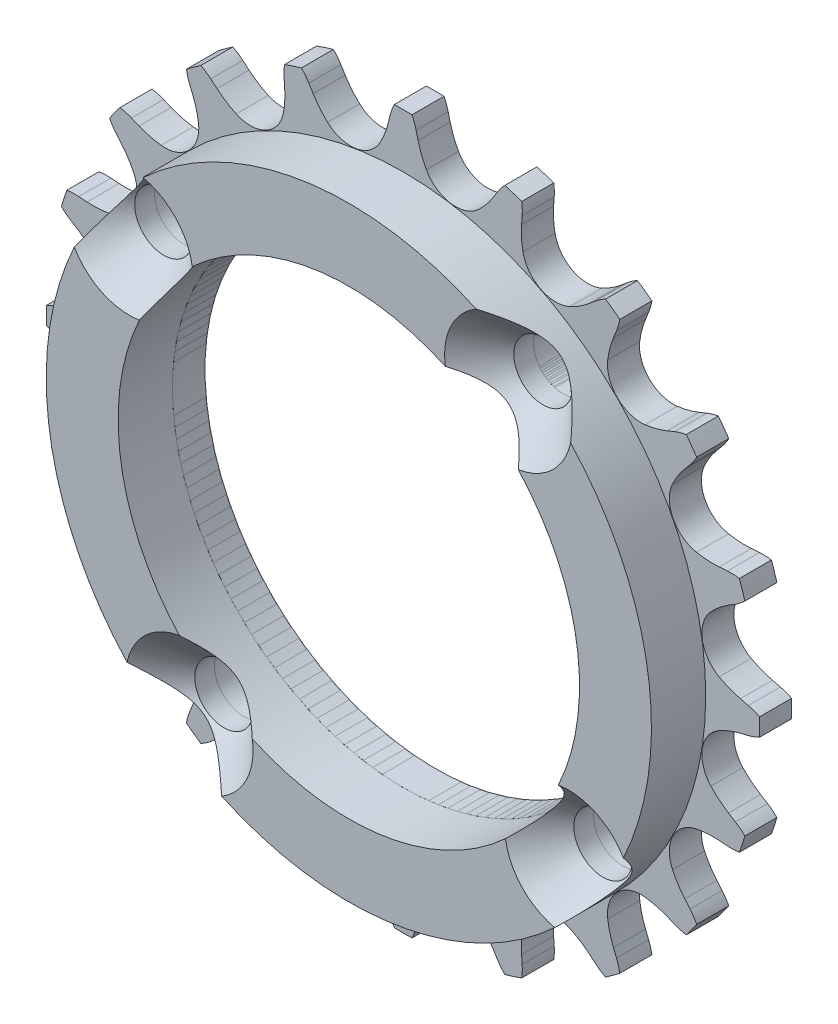
from build123d import *

# Parameters (mm, degrees)
SKETCH1_R                                    = 6.787119857
BOSS_EXTRUDE1_DEPTH                          = 2.3622
SKETCH2_R                                    = 18
BOSS_EXTRUDE2_DEPTH                          = 2.4
SKETCH3_R                                    = 17
CUT_EXTRUDE1_DEPTH                           = 2.4
SKETCH6_R                                    = 22.300536673
SKETCH6_R_2                                  = 17
BOSS_EXTRUDE3_DEPTH                          = 4
SKETCH5_R                                    = 2
CUT_EXTRUDE3_DEPTH                           = 38.700373301
CSK_FOR_M4_COUNTERSUNK_FLAT_HEAD_SCR_2_COUNT = 2
CSK_FOR_M4_COUNTERSUNK_FLAT_HEAD_SCR_2_PITCH = 28.284271247
CSK_FOR_M4_COUNTERSUNK_FLAT_HEAD_SCR_3_COUNT = 2
CSK_FOR_M4_COUNTERSUNK_FLAT_HEAD_SCR_3_PITCH = 40
CSK_FOR_M4_COUNTERSUNK_FLAT_HEAD_SCR_4_COUNT = 2
CSK_FOR_M4_COUNTERSUNK_FLAT_HEAD_SCR_4_PITCH = 28.284271247


with BuildPart() as part:
    # Sketch1 → Boss-Extrude1 (new body)
    with BuildSketch(Plane.XY.offset(0.25)):
        with BuildLine():
            Line((-24.488227524, 6.948596415), (-23.976513369, 6.631320197))
            ThreePointArc((-23.976513369, 6.631320197), (-23.291994454, 6.141252786), (-22.678303214, 5.564958353))
            ThreePointArc((-22.678303214, 5.564958353), (-22.044379306, 3.491486679), (-23.288014754, 1.715391192))
            ThreePointArc((-23.288014754, 1.715391192), (-24.04975458, 1.356943638), (-24.852209913, 1.102389812))
            Line((-24.852209913, 1.102389812), (-25.436922738, 0.958770568))
            ThreePointArc((-25.436922738, 0.958770568), (-25.860833079, 0.829247508), (-26.267723996, 0.653418098))
            ThreePointArc((-26.267723996, 0.653418098), (-26.275849732, 0), (-26.267723996, -0.653418098))
            ThreePointArc((-26.267723996, -0.653418098), (-25.860833079, -0.829247508), (-25.436922738, -0.958770568))
            Line((-25.436922738, -0.958770568), (-24.852209913, -1.102389812))
            ThreePointArc((-24.852209913, -1.102389812), (-24.04975458, -1.356943638), (-23.288014754, -1.715391192))
            ThreePointArc((-23.288014754, -1.715391192), (-22.044379306, -3.491486679), (-22.678303214, -5.564958353))
            ThreePointArc((-22.678303214, -5.564958353), (-23.291994454, -6.141252786), (-23.976513369, -6.631320197))
            Line((-23.976513369, -6.631320197), (-24.488227524, -6.948596415))
            ThreePointArc((-24.488227524, -6.948596415), (-24.851365389, -7.202775664), (-25.184007371, -7.495735579))
            ThreePointArc((-25.184007371, -7.495735579), (-24.989818108, -8.119684109), (-24.780172778, -8.738610658))
            ThreePointArc((-24.780172778, -8.738610658), (-24.338862244, -8.780098157), (-23.895674726, -8.772286407))
            Line((-23.895674726, -8.772286407), (-23.295198996, -8.728190226))
            ThreePointArc((-23.295198996, -8.728190226), (-22.453357164, -8.722312965), (-21.618133153, -8.827826296))
            ThreePointArc((-21.618133153, -8.827826296), (-19.886521867, -10.132688993), (-19.848681346, -12.300571001))
            ThreePointArc((-19.848681346, -12.300571001), (-20.254251625, -13.0383006), (-20.753828642, -13.715910381))
            Line((-20.753828642, -13.715910381), (-21.14245398, -14.175786366))
            ThreePointArc((-21.14245398, -14.175786366), (-21.409272906, -14.529740969), (-21.635104637, -14.911154431))
            ThreePointArc((-21.635104637, -14.911154431), (-21.257608974, -15.444556964), (-20.866965595, -15.968407121))
            ThreePointArc((-20.866965595, -15.968407121), (-20.434433994, -15.871491623), (-20.01535158, -15.727109732))
            Line((-20.01535158, -15.727109732), (-19.457891694, -15.499614567))
            ThreePointArc((-19.457891694, -15.499614567), (-18.659068707, -15.233881527), (-17.832118057, -15.076132254))
            ThreePointArc((-17.832118057, -15.076132254), (-15.782033111, -15.782033111), (-15.076132254, -17.832118057))
            ThreePointArc((-15.076132254, -17.832118057), (-15.233881527, -18.659068707), (-15.499614567, -19.457891694))
            Line((-15.499614567, -19.457891694), (-15.727109732, -20.01535158))
            ThreePointArc((-15.727109732, -20.01535158), (-15.871491623, -20.434433994), (-15.968407121, -20.866965595))
            ThreePointArc((-15.968407121, -20.866965595), (-15.444556964, -21.257608974), (-14.911154431, -21.635104637))
            ThreePointArc((-14.911154431, -21.635104637), (-14.529740969, -21.409272906), (-14.175786366, -21.14245398))
            Line((-14.175786366, -21.14245398), (-13.715910381, -20.753828642))
            ThreePointArc((-13.715910381, -20.753828642), (-13.0383006, -20.254251625), (-12.300571001, -19.848681346))
            ThreePointArc((-12.300571001, -19.848681346), (-10.132688993, -19.886521867), (-8.827826296, -21.618133153))
            ThreePointArc((-8.827826296, -21.618133153), (-8.722312965, -22.453357164), (-8.728190226, -23.295198996))
            Line((-8.728190226, -23.295198996), (-8.772286407, -23.895674726))
            ThreePointArc((-8.772286407, -23.895674726), (-8.780098157, -24.338862244), (-8.738610658, -24.780172778))
            ThreePointArc((-8.738610658, -24.780172778), (-8.119684109, -24.989818108), (-7.495735579, -25.184007371))
            ThreePointArc((-7.495735579, -25.184007371), (-7.202775664, -24.851365389), (-6.948596415, -24.488227524))
            Line((-6.948596415, -24.488227524), (-6.631320197, -23.976513369))
            ThreePointArc((-6.631320197, -23.976513369), (-6.141252786, -23.291994454), (-5.564958353, -22.678303214))
            ThreePointArc((-5.564958353, -22.678303214), (-3.491486679, -22.044379306), (-1.715391192, -23.288014754))
            ThreePointArc((-1.715391192, -23.288014754), (-1.356943638, -24.04975458), (-1.102389812, -24.852209913))
            Line((-1.102389812, -24.852209913), (-0.958770568, -25.436922738))
            ThreePointArc((-0.958770568, -25.436922738), (-0.829247508, -25.860833079), (-0.653418098, -26.267723996))
            ThreePointArc((-0.653418098, -26.267723996), (0, -26.275849732), (0.653418098, -26.267723996))
            ThreePointArc((0.653418098, -26.267723996), (0.829247508, -25.860833079), (0.958770568, -25.436922738))
            Line((0.958770568, -25.436922738), (1.102389812, -24.852209913))
            ThreePointArc((1.102389812, -24.852209913), (1.356943638, -24.04975458), (1.715391192, -23.288014754))
            ThreePointArc((1.715391192, -23.288014754), (3.491486679, -22.044379306), (5.564958353, -22.678303214))
            ThreePointArc((5.564958353, -22.678303214), (6.141252786, -23.291994454), (6.631320197, -23.976513369))
            Line((6.631320197, -23.976513369), (6.948596415, -24.488227524))
            ThreePointArc((6.948596415, -24.488227524), (7.202775664, -24.851365389), (7.495735579, -25.184007371))
            ThreePointArc((7.495735579, -25.184007371), (8.119684109, -24.989818108), (8.738610658, -24.780172778))
            ThreePointArc((8.738610658, -24.780172778), (8.780098157, -24.338862244), (8.772286407, -23.895674726))
            Line((8.772286407, -23.895674726), (8.728190226, -23.295198996))
            ThreePointArc((8.728190226, -23.295198996), (8.722312965, -22.453357164), (8.827826296, -21.618133153))
            ThreePointArc((8.827826296, -21.618133153), (10.132688993, -19.886521867), (12.300571001, -19.848681346))
            ThreePointArc((12.300571001, -19.848681346), (13.0383006, -20.254251625), (13.715910381, -20.753828642))
            Line((13.715910381, -20.753828642), (14.175786366, -21.14245398))
            ThreePointArc((14.175786366, -21.14245398), (14.529740969, -21.409272906), (14.911154431, -21.635104637))
            ThreePointArc((14.911154431, -21.635104637), (15.444556964, -21.257608974), (15.968407121, -20.866965595))
            ThreePointArc((15.968407121, -20.866965595), (15.871491623, -20.434433994), (15.727109732, -20.01535158))
            Line((15.727109732, -20.01535158), (15.499614567, -19.457891694))
            ThreePointArc((15.499614567, -19.457891694), (15.233881527, -18.659068707), (15.076132254, -17.832118057))
            ThreePointArc((15.076132254, -17.832118057), (15.782033111, -15.782033111), (17.832118057, -15.076132254))
            ThreePointArc((17.832118057, -15.076132254), (18.659068707, -15.233881527), (19.457891694, -15.499614567))
            Line((19.457891694, -15.499614567), (20.01535158, -15.727109732))
            ThreePointArc((20.01535158, -15.727109732), (20.434433994, -15.871491623), (20.866965595, -15.968407121))
            ThreePointArc((20.866965595, -15.968407121), (21.257608974, -15.444556964), (21.635104637, -14.911154431))
            ThreePointArc((21.635104637, -14.911154431), (21.409272906, -14.529740969), (21.14245398, -14.175786366))
            Line((21.14245398, -14.175786366), (20.753828642, -13.715910381))
            ThreePointArc((20.753828642, -13.715910381), (20.254251625, -13.0383006), (19.848681346, -12.300571001))
            ThreePointArc((19.848681346, -12.300571001), (19.886521867, -10.132688993), (21.618133153, -8.827826296))
            ThreePointArc((21.618133153, -8.827826296), (22.453357164, -8.722312965), (23.295198996, -8.728190226))
            Line((23.295198996, -8.728190226), (23.895674726, -8.772286407))
            ThreePointArc((23.895674726, -8.772286407), (24.338862244, -8.780098157), (24.780172778, -8.738610658))
            ThreePointArc((24.780172778, -8.738610658), (24.989818108, -8.119684109), (25.184007371, -7.495735579))
            ThreePointArc((25.184007371, -7.495735579), (24.851365389, -7.202775664), (24.488227524, -6.948596415))
            Line((24.488227524, -6.948596415), (23.976513369, -6.631320197))
            ThreePointArc((23.976513369, -6.631320197), (23.291994454, -6.141252786), (22.678303214, -5.564958353))
            ThreePointArc((22.678303214, -5.564958353), (22.044379306, -3.491486679), (23.288014754, -1.715391192))
            ThreePointArc((23.288014754, -1.715391192), (24.04975458, -1.356943638), (24.852209913, -1.102389812))
            Line((24.852209913, -1.102389812), (25.436922738, -0.958770568))
            ThreePointArc((25.436922738, -0.958770568), (25.860833079, -0.829247508), (26.267723996, -0.653418098))
            ThreePointArc((26.267723996, -0.653418098), (26.275849732, 0), (26.267723996, 0.653418098))
            ThreePointArc((26.267723996, 0.653418098), (25.860833079, 0.829247508), (25.436922738, 0.958770568))
            Line((25.436922738, 0.958770568), (24.852209913, 1.102389812))
            ThreePointArc((24.852209913, 1.102389812), (24.04975458, 1.356943638), (23.288014754, 1.715391192))
            ThreePointArc((23.288014754, 1.715391192), (22.044379306, 3.491486679), (22.678303214, 5.564958353))
            ThreePointArc((22.678303214, 5.564958353), (23.291994454, 6.141252786), (23.976513369, 6.631320197))
            Line((23.976513369, 6.631320197), (24.488227524, 6.948596415))
            ThreePointArc((24.488227524, 6.948596415), (24.851365389, 7.202775664), (25.184007371, 7.495735579))
            ThreePointArc((25.184007371, 7.495735579), (24.989818108, 8.119684109), (24.780172778, 8.738610658))
            ThreePointArc((24.780172778, 8.738610658), (24.338862244, 8.780098157), (23.895674726, 8.772286407))
            Line((23.895674726, 8.772286407), (23.295198996, 8.728190226))
            ThreePointArc((23.295198996, 8.728190226), (22.453357164, 8.722312965), (21.618133153, 8.827826296))
            ThreePointArc((21.618133153, 8.827826296), (19.886521867, 10.132688993), (19.848681346, 12.300571001))
            ThreePointArc((19.848681346, 12.300571001), (20.254251625, 13.0383006), (20.753828642, 13.715910381))
            Line((20.753828642, 13.715910381), (21.14245398, 14.175786366))
            ThreePointArc((21.14245398, 14.175786366), (21.409272906, 14.529740969), (21.635104637, 14.911154431))
            ThreePointArc((21.635104637, 14.911154431), (21.257608974, 15.444556964), (20.866965595, 15.968407121))
            ThreePointArc((20.866965595, 15.968407121), (20.434433994, 15.871491623), (20.01535158, 15.727109732))
            Line((20.01535158, 15.727109732), (19.457891694, 15.499614567))
            ThreePointArc((19.457891694, 15.499614567), (18.659068707, 15.233881527), (17.832118057, 15.076132254))
            ThreePointArc((17.832118057, 15.076132254), (15.782033111, 15.782033111), (15.076132254, 17.832118057))
            ThreePointArc((15.076132254, 17.832118057), (15.233881527, 18.659068707), (15.499614567, 19.457891694))
            Line((15.499614567, 19.457891694), (15.727109732, 20.01535158))
            ThreePointArc((15.727109732, 20.01535158), (15.871491623, 20.434433994), (15.968407121, 20.866965595))
            ThreePointArc((15.968407121, 20.866965595), (15.444556964, 21.257608974), (14.911154431, 21.635104637))
            ThreePointArc((14.911154431, 21.635104637), (14.529740969, 21.409272906), (14.175786366, 21.14245398))
            Line((14.175786366, 21.14245398), (13.715910381, 20.753828642))
            ThreePointArc((13.715910381, 20.753828642), (13.0383006, 20.254251625), (12.300571001, 19.848681346))
            ThreePointArc((12.300571001, 19.848681346), (10.132688993, 19.886521867), (8.827826296, 21.618133153))
            ThreePointArc((8.827826296, 21.618133153), (8.722312965, 22.453357164), (8.728190226, 23.295198996))
            Line((8.728190226, 23.295198996), (8.772286407, 23.895674726))
            ThreePointArc((8.772286407, 23.895674726), (8.780098157, 24.338862244), (8.738610658, 24.780172778))
            ThreePointArc((8.738610658, 24.780172778), (8.119684109, 24.989818108), (7.495735579, 25.184007371))
            ThreePointArc((7.495735579, 25.184007371), (7.202775664, 24.851365389), (6.948596415, 24.488227524))
            Line((6.948596415, 24.488227524), (6.631320197, 23.976513369))
            ThreePointArc((6.631320197, 23.976513369), (6.141252786, 23.291994454), (5.564958353, 22.678303214))
            ThreePointArc((5.564958353, 22.678303214), (3.491486679, 22.044379306), (1.715391192, 23.288014754))
            ThreePointArc((1.715391192, 23.288014754), (1.356943638, 24.04975458), (1.102389812, 24.852209913))
            Line((1.102389812, 24.852209913), (0.958770568, 25.436922738))
            ThreePointArc((0.958770568, 25.436922738), (0.829247508, 25.860833079), (0.653418098, 26.267723996))
            ThreePointArc((0.653418098, 26.267723996), (0, 26.275849732), (-0.653418098, 26.267723996))
            ThreePointArc((-0.653418098, 26.267723996), (-0.829247508, 25.860833079), (-0.958770568, 25.436922738))
            Line((-0.958770568, 25.436922738), (-1.102389812, 24.852209913))
            ThreePointArc((-1.102389812, 24.852209913), (-1.356943638, 24.04975458), (-1.715391192, 23.288014754))
            ThreePointArc((-1.715391192, 23.288014754), (-3.491486679, 22.044379306), (-5.564958353, 22.678303214))
            ThreePointArc((-5.564958353, 22.678303214), (-6.141252786, 23.291994454), (-6.631320197, 23.976513369))
            Line((-6.631320197, 23.976513369), (-6.948596415, 24.488227524))
            ThreePointArc((-6.948596415, 24.488227524), (-7.202775664, 24.851365389), (-7.495735579, 25.184007371))
            ThreePointArc((-7.495735579, 25.184007371), (-8.119684109, 24.989818108), (-8.738610658, 24.780172778))
            ThreePointArc((-8.738610658, 24.780172778), (-8.780098157, 24.338862244), (-8.772286407, 23.895674726))
            Line((-8.772286407, 23.895674726), (-8.728190226, 23.295198996))
            ThreePointArc((-8.728190226, 23.295198996), (-8.722312965, 22.453357164), (-8.827826296, 21.618133153))
            ThreePointArc((-8.827826296, 21.618133153), (-10.132688993, 19.886521867), (-12.300571001, 19.848681346))
            ThreePointArc((-12.300571001, 19.848681346), (-13.0383006, 20.254251625), (-13.715910381, 20.753828642))
            Line((-13.715910381, 20.753828642), (-14.175786366, 21.14245398))
            ThreePointArc((-14.175786366, 21.14245398), (-14.529740969, 21.409272906), (-14.911154431, 21.635104637))
            ThreePointArc((-14.911154431, 21.635104637), (-15.444556964, 21.257608974), (-15.968407121, 20.866965595))
            ThreePointArc((-15.968407121, 20.866965595), (-15.871491623, 20.434433994), (-15.727109732, 20.01535158))
            Line((-15.727109732, 20.01535158), (-15.499614567, 19.457891694))
            ThreePointArc((-15.499614567, 19.457891694), (-15.233881527, 18.659068707), (-15.076132254, 17.832118057))
            ThreePointArc((-15.076132254, 17.832118057), (-15.782033111, 15.782033111), (-17.832118057, 15.076132254))
            ThreePointArc((-17.832118057, 15.076132254), (-18.659068707, 15.233881527), (-19.457891694, 15.499614567))
            Line((-19.457891694, 15.499614567), (-20.01535158, 15.727109732))
            ThreePointArc((-20.01535158, 15.727109732), (-20.434433994, 15.871491623), (-20.866965595, 15.968407121))
            ThreePointArc((-20.866965595, 15.968407121), (-21.257608974, 15.444556964), (-21.635104637, 14.911154431))
            ThreePointArc((-21.635104637, 14.911154431), (-21.409272906, 14.529740969), (-21.14245398, 14.175786366))
            Line((-21.14245398, 14.175786366), (-20.753828642, 13.715910381))
            ThreePointArc((-20.753828642, 13.715910381), (-20.254251625, 13.0383006), (-19.848681346, 12.300571001))
            ThreePointArc((-19.848681346, 12.300571001), (-19.886521867, 10.132688993), (-21.618133153, 8.827826296))
            ThreePointArc((-21.618133153, 8.827826296), (-22.453357164, 8.722312965), (-23.295198996, 8.728190226))
            Line((-23.295198996, 8.728190226), (-23.895674726, 8.772286407))
            ThreePointArc((-23.895674726, 8.772286407), (-24.338862244, 8.780098157), (-24.780172778, 8.738610658))
            ThreePointArc((-24.780172778, 8.738610658), (-24.989818108, 8.119684109), (-25.184007371, 7.495735579))
            ThreePointArc((-25.184007371, 7.495735579), (-24.851365389, 7.202775664), (-24.488227524, 6.948596415))
        make_face()
        with Locations(Location((0, 0, 0), (0, 0, 180))):
            Circle(SKETCH1_R, mode=Mode.SUBTRACT)
        with BuildLine():
            Line((6.385503129, 9.127913687), (6.856026394, 9.598436951))
            ThreePointArc((6.856026394, 9.598436951), (9.598436951, 9.598436951), (9.598436951, 6.856026394))
            Line((9.598436951, 6.856026394), (9.127913687, 6.385503129))
            ThreePointArc((9.127913687, 6.385503129), (6.385503129, 6.385503129), (6.385503129, 9.127913687))
        make_face(mode=Mode.SUBTRACT)
        with BuildLine():
            Line((9.127913687, -6.385503129), (9.598436951, -6.856026394))
            ThreePointArc((9.598436951, -6.856026394), (9.598436951, -9.598436951), (6.856026394, -9.598436951))
            Line((6.856026394, -9.598436951), (6.385503129, -9.127913687))
            ThreePointArc((6.385503129, -9.127913687), (6.385503129, -6.385503129), (9.127913687, -6.385503129))
        make_face(mode=Mode.SUBTRACT)
        with BuildLine():
            Line((-6.385503129, -9.127913687), (-6.856026394, -9.598436951))
            ThreePointArc((-6.856026394, -9.598436951), (-9.598436951, -9.598436951), (-9.598436951, -6.856026394))
            Line((-9.598436951, -6.856026394), (-9.127913687, -6.385503129))
            ThreePointArc((-9.127913687, -6.385503129), (-6.385503129, -6.385503129), (-6.385503129, -9.127913687))
        make_face(mode=Mode.SUBTRACT)
        with BuildLine():
            Line((1.939177102, 15.513416816), (1.939177102, 10.96964223))
            ThreePointArc((1.939177102, 10.96964223), (0, 9.030465128), (-1.939177102, 10.96964223))
            Line((-1.939177102, 10.96964223), (-1.939177102, 15.513416816))
            ThreePointArc((-1.939177102, 15.513416816), (0, 17.452593918), (1.939177102, 15.513416816))
        make_face(mode=Mode.SUBTRACT)
        with BuildLine():
            Line((-1.939177102, -15.513416816), (-1.939177102, -10.96964223))
            ThreePointArc((-1.939177102, -10.96964223), (0, -9.030465128), (1.939177102, -10.96964223))
            Line((1.939177102, -10.96964223), (1.939177102, -15.513416816))
            ThreePointArc((1.939177102, -15.513416816), (0, -17.452593918), (-1.939177102, -15.513416816))
        make_face(mode=Mode.SUBTRACT)
        with BuildLine():
            Line((15.513416816, -1.939177102), (10.96964223, -1.939177102))
            ThreePointArc((10.96964223, -1.939177102), (9.030465128, 0), (10.96964223, 1.939177102))
            Line((10.96964223, 1.939177102), (15.513416816, 1.939177102))
            ThreePointArc((15.513416816, 1.939177102), (17.452593918, 0), (15.513416816, -1.939177102))
        make_face(mode=Mode.SUBTRACT)
        with BuildLine():
            Line((-15.513416816, 1.939177102), (-10.96964223, 1.939177102))
            ThreePointArc((-10.96964223, 1.939177102), (-9.030465128, 0), (-10.96964223, -1.939177102))
            Line((-10.96964223, -1.939177102), (-15.513416816, -1.939177102))
            ThreePointArc((-15.513416816, -1.939177102), (-17.452593918, 0), (-15.513416816, 1.939177102))
        make_face(mode=Mode.SUBTRACT)
        with BuildLine():
            Line((-6.856026394, 9.598436951), (-6.385503129, 9.127913687))
            ThreePointArc((-6.385503129, 9.127913687), (-6.385503129, 6.385503129), (-9.127913687, 6.385503129))
            Line((-9.127913687, 6.385503129), (-9.598436951, 6.856026394))
            ThreePointArc((-9.598436951, 6.856026394), (-9.598436951, 9.598436951), (-6.856026394, 9.598436951))
        make_face(mode=Mode.SUBTRACT)
    extrude(amount=-BOSS_EXTRUDE1_DEPTH)


with BuildPart() as body_2:
    # Sketch2 → Boss-Extrude2 (new body)
    with BuildSketch(Plane.XY.offset(0.25)):
        Circle(SKETCH2_R)
    extrude(amount=-BOSS_EXTRUDE2_DEPTH)


with BuildPart() as cut_extrude1_tool:
    # Sketch3 → Cut-Extrude1 (new body)
    with BuildSketch(Plane.XY.offset(0.25)):
        Circle(SKETCH3_R)
    extrude(amount=-CUT_EXTRUDE1_DEPTH)


with BuildPart() as part_1:
    add(part.part)

    # Cut-Extrude1: cut by cut_extrude1_tool
    add(cut_extrude1_tool.part, mode=Mode.SUBTRACT)


with BuildPart() as body_2_1:
    add(body_2.part)

    # Cut-Extrude1: cut by cut_extrude1_tool
    add(cut_extrude1_tool.part, mode=Mode.SUBTRACT)


with BuildPart() as body_3:
    # Sketch6 → Boss-Extrude3 (new body)
    with BuildSketch(Plane.XY.offset(0.25)):
        Circle(SKETCH6_R)
        Circle(SKETCH6_R_2, mode=Mode.SUBTRACT)
    extrude(amount=BOSS_EXTRUDE3_DEPTH)


with BuildPart() as cut_extrude3_tool:
    # Sketch5 → Cut-Extrude3 (new, through all)
    with BuildSketch(Plane(origin=(0, 0, -2.1122), x_dir=(-1, 0, 0), z_dir=(0, 0, -1))):
        with BuildLine():
            ThreePointArc((18.180339887, 11.755705046), (18.08245292, 12.373739035), (17.798373876, 12.93127555))
            Line((17.798373876, 12.93127555), (14.562305899, 10.580134541))
            ThreePointArc((14.562305899, 10.580134541), (16.798373876, 9.853592013), (18.180339887, 11.755705046))
        make_face()
        with BuildLine():
            Line((14.562305899, 10.580134541), (17.798373876, 12.93127555))
            ThreePointArc((17.798373876, 12.93127555), (15.004769383, 13.373739035), (14.562305899, 10.580134541))
        make_face()
        with Locations((11.755705046, -16.180339887)):
            Circle(SKETCH5_R)
        with Locations((-16.180339887, -11.755705046)):
            Circle(SKETCH5_R)
        with Locations((-11.755705046, 16.180339887)):
            Circle(SKETCH5_R)
    extrude(amount=-CUT_EXTRUDE3_DEPTH)


with BuildPart() as part_2:
    add(part_1.part)

    # Cut-Extrude3: cut by cut_extrude3_tool
    add(cut_extrude3_tool.part, mode=Mode.SUBTRACT)


with BuildPart() as body_3_1:
    add(body_3.part)

    # Cut-Extrude3: cut by cut_extrude3_tool
    add(cut_extrude3_tool.part, mode=Mode.SUBTRACT)


with BuildPart() as csk_for_m4_countersunk_flat_head_screw1_tool:
    # Sketch8 → CSK for M4 Countersunk Flat Head Screw1 (revolve)
    with BuildSketch(Plane(origin=(-16.180339887, 11.755705046, 4.25), x_dir=(0, -1, 0), z_dir=(1, 0, 0))):
        Polygon((0, 0), (0, 6.4), (2.15, 6.4), (2.15, 2.55), (4.7, 0), align=None)
    csk_for_m4_countersunk_flat_head_screw1 = revolve(axis=Axis((-16.180339887, 11.755705046, 10.6), (0, 0, -1)))


with BuildPart() as part_3:
    add(part_2.part)

    # CSK for M4 Countersunk Flat Head Screw1: cut by csk_for_m4_countersunk_flat_head_screw1_tool
    add(csk_for_m4_countersunk_flat_head_screw1_tool.part, mode=Mode.SUBTRACT)


with BuildPart() as body_2_2:
    add(body_2_1.part)

    # CSK for M4 Countersunk Flat Head Screw1: cut by csk_for_m4_countersunk_flat_head_screw1_tool
    add(csk_for_m4_countersunk_flat_head_screw1_tool.part, mode=Mode.SUBTRACT)


with BuildPart() as body_3_2:
    add(body_3_1.part)

    # CSK for M4 Countersunk Flat Head Screw1: cut by csk_for_m4_countersunk_flat_head_screw1_tool
    add(csk_for_m4_countersunk_flat_head_screw1_tool.part, mode=Mode.SUBTRACT)


with BuildPart() as csk_for_m4_countersunk_flat_head_scr_2_tool:
    # CSK for M4 Countersunk Flat Head Scr 2: CSK for M4 Countersunk Flat Head Screw1 ×2
    with Locations(*[Vector(0.15643446504019418, -0.9876883405951435, 0) * (i * CSK_FOR_M4_COUNTERSUNK_FLAT_HEAD_SCR_2_PITCH) for i in range(1, CSK_FOR_M4_COUNTERSUNK_FLAT_HEAD_SCR_2_COUNT)]):
        add(csk_for_m4_countersunk_flat_head_screw1)


with BuildPart() as part_4:
    add(part_3.part)

    # CSK for M4 Countersunk Flat Head Scr 2: cut by csk_for_m4_countersunk_flat_head_scr_2_tool
    add(csk_for_m4_countersunk_flat_head_scr_2_tool.part, mode=Mode.SUBTRACT)


with BuildPart() as body_2_3:
    add(body_2_2.part)

    # CSK for M4 Countersunk Flat Head Scr 2: cut by csk_for_m4_countersunk_flat_head_scr_2_tool
    add(csk_for_m4_countersunk_flat_head_scr_2_tool.part, mode=Mode.SUBTRACT)


with BuildPart() as body_3_3:
    add(body_3_2.part)

    # CSK for M4 Countersunk Flat Head Scr 2: cut by csk_for_m4_countersunk_flat_head_scr_2_tool
    add(csk_for_m4_countersunk_flat_head_scr_2_tool.part, mode=Mode.SUBTRACT)


with BuildPart() as csk_for_m4_countersunk_flat_head_scr_3_tool:
    # CSK for M4 Countersunk Flat Head Scr 3: CSK for M4 Countersunk Flat Head Screw1 ×2
    with Locations(*[Vector(0.8090169943749256, -0.5877852522925033, 0) * (i * CSK_FOR_M4_COUNTERSUNK_FLAT_HEAD_SCR_3_PITCH) for i in range(1, CSK_FOR_M4_COUNTERSUNK_FLAT_HEAD_SCR_3_COUNT)]):
        add(csk_for_m4_countersunk_flat_head_screw1)


with BuildPart() as part_5:
    add(part_4.part)

    # CSK for M4 Countersunk Flat Head Scr 3: cut by csk_for_m4_countersunk_flat_head_scr_3_tool
    add(csk_for_m4_countersunk_flat_head_scr_3_tool.part, mode=Mode.SUBTRACT)


with BuildPart() as body_2_4:
    add(body_2_3.part)

    # CSK for M4 Countersunk Flat Head Scr 3: cut by csk_for_m4_countersunk_flat_head_scr_3_tool
    add(csk_for_m4_countersunk_flat_head_scr_3_tool.part, mode=Mode.SUBTRACT)


with BuildPart() as body_3_4:
    add(body_3_3.part)

    # CSK for M4 Countersunk Flat Head Scr 3: cut by csk_for_m4_countersunk_flat_head_scr_3_tool
    add(csk_for_m4_countersunk_flat_head_scr_3_tool.part, mode=Mode.SUBTRACT)


with BuildPart() as csk_for_m4_countersunk_flat_head_scr_4_tool:
    # CSK for M4 Countersunk Flat Head Scr 4: CSK for M4 Countersunk Flat Head Screw1 ×2
    with Locations(*[Vector(0.9876883405951437, 0.15643446504019398, 0) * (i * CSK_FOR_M4_COUNTERSUNK_FLAT_HEAD_SCR_4_PITCH) for i in range(1, CSK_FOR_M4_COUNTERSUNK_FLAT_HEAD_SCR_4_COUNT)]):
        add(csk_for_m4_countersunk_flat_head_screw1)


with BuildPart() as part_6:
    add(part_5.part)

    # CSK for M4 Countersunk Flat Head Scr 4: cut by csk_for_m4_countersunk_flat_head_scr_4_tool
    add(csk_for_m4_countersunk_flat_head_scr_4_tool.part, mode=Mode.SUBTRACT)


with BuildPart() as body_2_5:
    add(body_2_4.part)

    # CSK for M4 Countersunk Flat Head Scr 4: cut by csk_for_m4_countersunk_flat_head_scr_4_tool
    add(csk_for_m4_countersunk_flat_head_scr_4_tool.part, mode=Mode.SUBTRACT)


with BuildPart() as body_3_5:
    add(body_3_4.part)

    # CSK for M4 Countersunk Flat Head Scr 4: cut by csk_for_m4_countersunk_flat_head_scr_4_tool
    add(csk_for_m4_countersunk_flat_head_scr_4_tool.part, mode=Mode.SUBTRACT)


solid = Compound([part_6.part, body_2_5.part, body_3_5.part])
